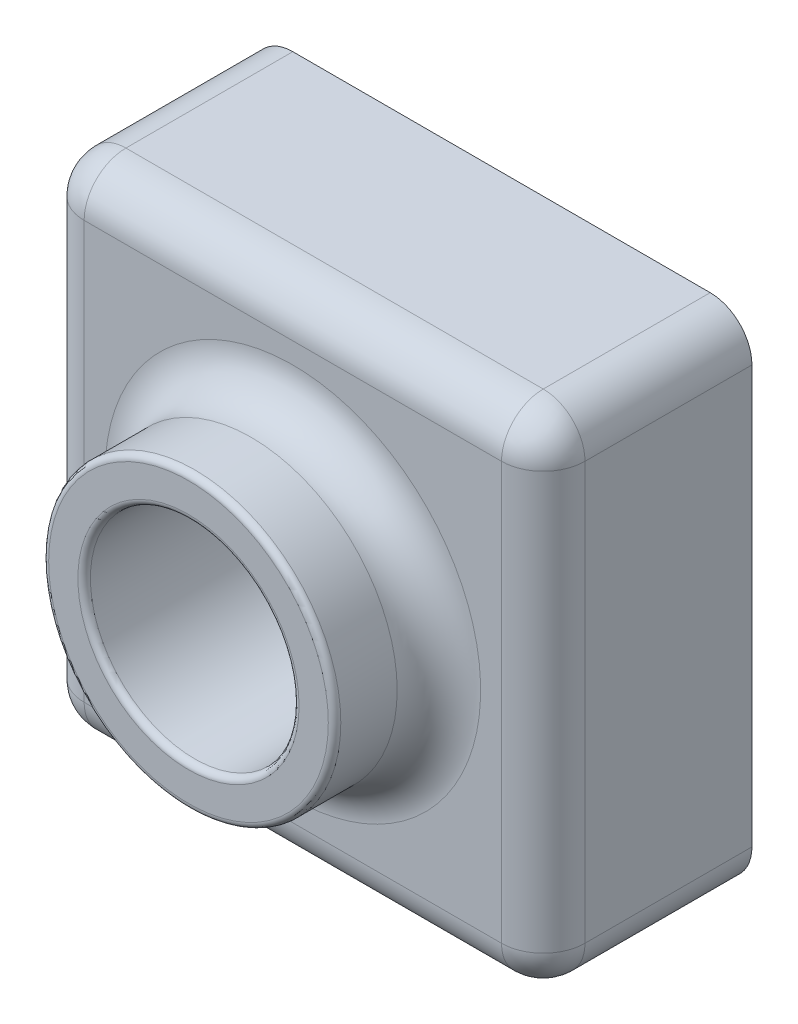
from build123d import *

# Parameters (mm, degrees)
CROQUIS2_W              = 120
CROQUIS2_H              = 120
SALIENTE_EXTRUIR1_DEPTH = 50
CROQUIS3_R              = 35
SALIENTE_EXTRUIR2_DEPTH = 25
CROQUIS6_R              = 25
SALIENTE_EXTRUIR3_DEPTH = 75
CROQUIS6_2_R            = 25
CORTAR_EXTRUIR1_DEPTH   = 186.539753153
REDONDEO1_R             = 10
REDONDEO2_R             = 1.5
VACIADO1_T              = -2


with BuildPart() as part:
    # Croquis2 → Saliente-Extruir1 (new body)
    with BuildSketch(Plane.XY):
        with Locations((60, 60)):
            Rectangle(CROQUIS2_W, CROQUIS2_H)
    extrude(amount=SALIENTE_EXTRUIR1_DEPTH)

    # Croquis3 → Saliente-Extruir2 (add)
    with BuildSketch(Plane.XY.offset(50)):
        with Locations(Location((60, 60, 0), (0, 0, 180))):
            Circle(CROQUIS3_R)
    extrude(amount=SALIENTE_EXTRUIR2_DEPTH)

    # Croquis6 → Saliente-Extruir3 (add, through all)
    with BuildSketch(Plane.XY.offset(75)):
        with Locations((60, 60)):
            Circle(CROQUIS6_R)
    extrude(amount=-SALIENTE_EXTRUIR3_DEPTH)

    # Croquis6<2> → Cortar-Extruir1 (cut, through all)
    with BuildSketch(Plane.XY.offset(75)):
        with Locations((60, 60)):
            Circle(CROQUIS6_2_R)
    extrude(amount=-CORTAR_EXTRUIR1_DEPTH, mode=Mode.SUBTRACT)

    # Redondeo1
    redondeo1_edges = [part.edges().sort_by_distance(p)[0] for p in [
        (120, 60, 50),
        (60, 120, 50),
        (95, 60, 50),
        (0, 60, 50),
        (60, 0, 50),
        (0, 120, 25),
        (120, 120, 25),
        (120, 0, 25),
        (0, 0, 25),
    ]]
    fillet(redondeo1_edges, radius=REDONDEO1_R)

    # Redondeo2
    redondeo2_edges = [part.edges().sort_by_distance(p)[0] for p in [
        (95, 60, 75),
        (35, 60, 75),
    ]]
    fillet(redondeo2_edges, radius=REDONDEO2_R)

    # Vaciado1
    vaciado1_openings = [part.faces().sort_by_distance(p)[0] for p in [
        (60, 1.697056275, 0),
    ]]
    offset(amount=VACIADO1_T, openings=vaciado1_openings, kind=Kind.INTERSECTION)


solid = part.part
